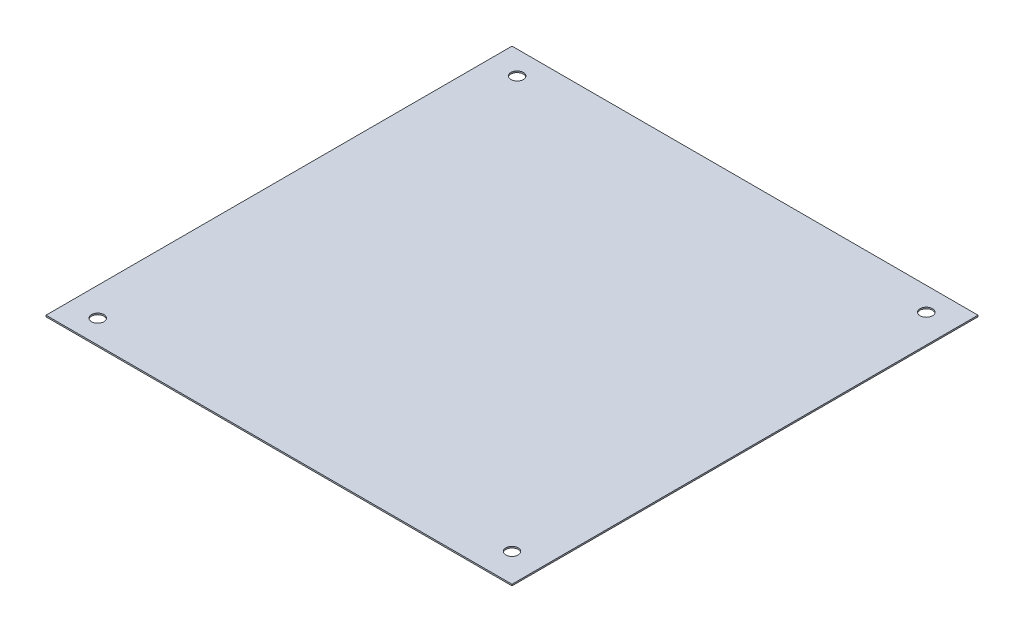
from build123d import *

# Parameters (mm, degrees)
SKETCH1_W           = 254
SKETCH1_H           = 254
SKETCH1_R           = 3.3782
BOSS_EXTRUDE1_DEPTH = 0.79375


with BuildPart() as part:
    # Sketch1 → Boss-Extrude1 (new body)
    with BuildSketch(Plane(origin=(0, 0, 0), x_dir=(1, 0, 0), z_dir=(0, 1, 0))):
        Rectangle(SKETCH1_W, SKETCH1_H)
        with Locations(Location((-111.506, 114.3, 0), (0, 0, 270))):
            Circle(SKETCH1_R, mode=Mode.SUBTRACT)
        with Locations(Location((111.506, 114.3, 0), (0, 0, 270))):
            Circle(SKETCH1_R, mode=Mode.SUBTRACT)
        with Locations(Location((111.506, -111.506, 0), (0, 0, 270))):
            Circle(SKETCH1_R, mode=Mode.SUBTRACT)
        with Locations(Location((-111.506, -114.3, 0), (0, 0, 270))):
            Circle(SKETCH1_R, mode=Mode.SUBTRACT)
    extrude(amount=BOSS_EXTRUDE1_DEPTH)


solid = part.part
